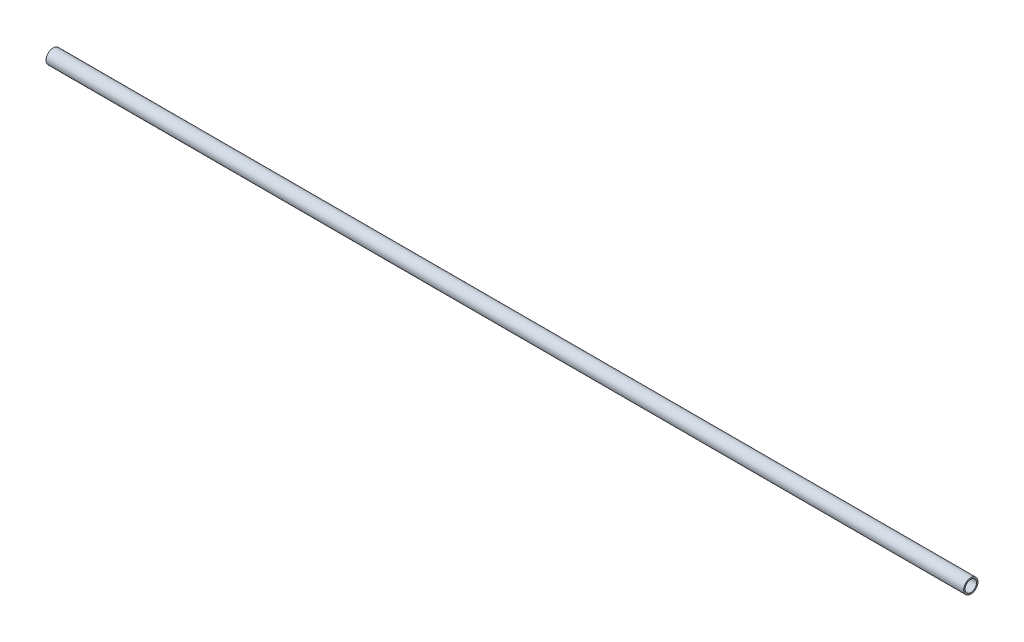
from build123d import *

# Parameters (mm, degrees)
SKIZZE1_R                       = 1.25
SKIZZE1_R_2                     = 1
AUFSATZ_LINEAR_AUSTRAGEN1_DEPTH = 80


with BuildPart() as part:
    # Skizze1 → Aufsatz-Linear austragen1 (new, symmetric)
    with BuildSketch(Plane(origin=(0, 0, 0), x_dir=(0, 0, -1), z_dir=(1, 0, 0))):
        Circle(SKIZZE1_R)
        Circle(SKIZZE1_R_2, mode=Mode.SUBTRACT)
    extrude(amount=AUFSATZ_LINEAR_AUSTRAGEN1_DEPTH, both=True)


solid = part.part
